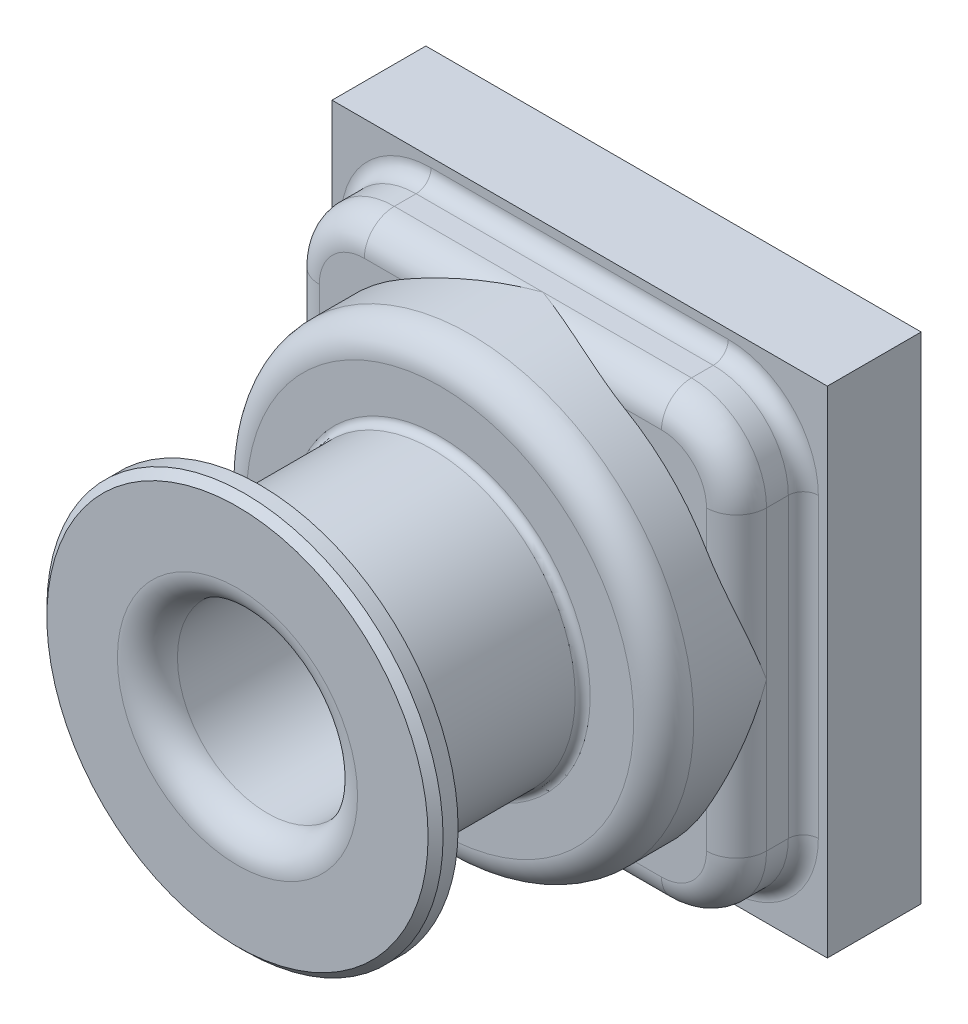
from build123d import *

# Parameters (mm, degrees)
ESQUISSE1_W        = 3.3
ESQUISSE1_H        = 3.3
BASE_DEPTH         = 0.625
BOSS_EXTRU_2_DEPTH = 0.445
CONG_1_R           = 0.2
ESQUISSE3_R        = 1.49
BOSS_EXTRU_3_DEPTH = 0.93
CONG_2_R           = 0.1
ESQUISSE4_R        = 0.95
ESQUISSE4_R_2      = 0.6
BOSS_EXTRU_4_DEPTH = 1.2
ESQUISSE6_R        = 1.32
ESQUISSE6_R_2      = 0.6
BOSS_EXTRU_5_DEPTH = 0.15
CHANFREIN1_SIZE    = 0.05
CONG_3_R           = 0.05
CONG_4_R           = 0.2


with BuildPart() as part:
    # Esquisse1 → base (new body)
    with BuildSketch(Plane.XY):
        Rectangle(ESQUISSE1_W, ESQUISSE1_H)
    extrude(amount=BASE_DEPTH)

    # Esquisse2 → Boss.-Extru.2 (add)
    with BuildSketch(Plane.XY.offset(0.625)):
        with BuildLine():
            Line((-0.99, 1.49), (0.99, 1.49))
            ThreePointArc((0.99, 1.49), (1.343553391, 1.343553391), (1.49, 0.99))
            Line((1.49, 0.99), (1.49, -0.99))
            ThreePointArc((1.49, -0.99), (1.343553391, -1.343553391), (0.99, -1.49))
            Line((0.99, -1.49), (-0.99, -1.49))
            ThreePointArc((-0.99, -1.49), (-1.343553391, -1.343553391), (-1.49, -0.99))
            Line((-1.49, -0.99), (-1.49, 0.99))
            ThreePointArc((-1.49, 0.99), (-1.343553391, 1.343553391), (-0.99, 1.49))
        make_face()
    extrude(amount=BOSS_EXTRU_2_DEPTH)

    # Congé1
    cong_1_edges = [part.edges().sort_by_distance(p)[0] for p in [
        (-1.343553391, -1.343553391, 1.07),
        (0, -1.49, 1.07),
        (1.343553391, -1.343553391, 1.07),
        (1.49, 0, 1.07),
        (1.343553391, 1.343553391, 1.07),
        (0, 1.49, 1.07),
        (-1.343553391, 1.343553391, 1.07),
        (-1.49, 0, 1.07),
    ]]
    fillet(cong_1_edges, radius=CONG_1_R)

    # Esquisse3 → Boss.-Extru.3 (add)
    with BuildSketch(Plane.XY.offset(0.625)):
        Circle(ESQUISSE3_R)
    extrude(amount=BOSS_EXTRU_3_DEPTH)

    # Congé2
    cong_2_edges = [part.edges().sort_by_distance(p)[0] for p in [
        (-1.343553391, -1.343553391, 0.625),
        (0, -1.49, 0.625),
        (1.343553391, -1.343553391, 0.625),
        (1.49, 0, 0.625),
        (1.343553391, 1.343553391, 0.625),
        (0, 1.49, 0.625),
        (-1.343553391, 1.343553391, 0.625),
        (-1.49, 0, 0.625),
    ]]
    fillet(cong_2_edges, radius=CONG_2_R)

    # Esquisse4 → Boss.-Extru.4 (add)
    with BuildSketch(Plane.XY.offset(1.555)):
        Circle(ESQUISSE4_R)
        Circle(ESQUISSE4_R_2, mode=Mode.SUBTRACT)
    extrude(amount=BOSS_EXTRU_4_DEPTH)

    # Esquisse6 → Boss.-Extru.5 (add)
    with BuildSketch(Plane.XY.offset(2.755)):
        Circle(ESQUISSE6_R)
        Circle(ESQUISSE6_R_2, mode=Mode.SUBTRACT)
    extrude(amount=BOSS_EXTRU_5_DEPTH)

    # Chanfrein1
    chanfrein1_edges = [part.edges().sort_by_distance(p)[0] for p in [
        (-1.32, 0, 2.905),
    ]]
    chamfer(chanfrein1_edges, length=CHANFREIN1_SIZE)

    # Congé3
    cong_3_edges = [part.edges().sort_by_distance(p)[0] for p in [
        (-0.95, 0, 2.755),
        (-0.95, 0, 1.555),
    ]]
    fillet(cong_3_edges, radius=CONG_3_R)

    # Congé4
    cong_4_edges = [part.edges().sort_by_distance(p)[0] for p in [
        (-0.6, 0, 2.905),
        (-1.49, 0, 1.555),
    ]]
    fillet(cong_4_edges, radius=CONG_4_R)


solid = part.part
